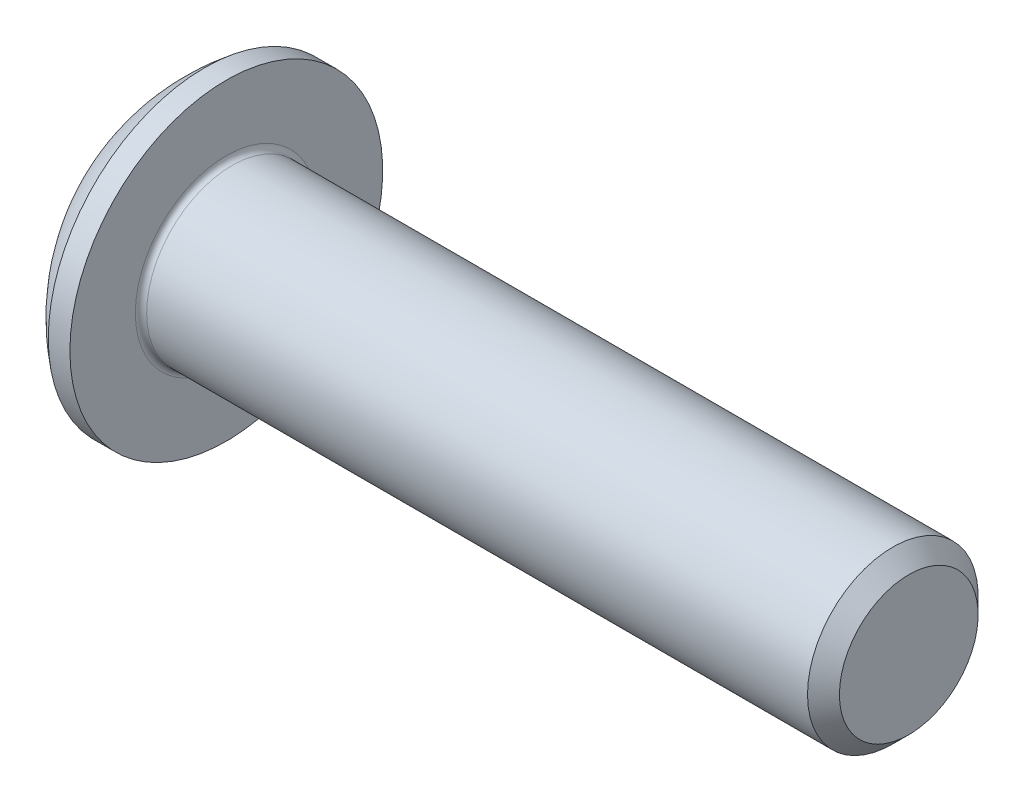
from build123d import *

# Parameters (mm, degrees)
FILLET1_R   = 0.1
HEX_2_DEPTH = 1.04


with BuildPart() as part:
    # BodySke → BaseBody (revolve)
    with BuildSketch(Plane.XY, mode=Mode.PRIVATE) as basebody_sk:
        with BuildLine():
            Line((13.45, 0), (13.45, 1.2195))
            Line((13.45, 1.2195), (13.1695, 1.5))
            Line((13.1695, 1.5), (1.45, 1.5))
            Line((1.45, 1.5), (1.45, 2.75))
            Line((1.45, 2.75), (1.07, 2.75))
            ThreePointArc((1.07, 2.75), (0.447284799, 2.130758374), (0, 1.375))
            Line((0, 1.375), (0, 0))
            Line((0, 0), (13.45, 0))
        make_face()
    revolve(basebody_sk.sketch.rotate(Axis((0, 0, 0), (1, 0, 0)), 90), axis=Axis((0, 0, 0), (1, 0, 0)))

    # Fillet1
    fillet1_edges = [part.edges().sort_by_distance(p)[0] for p in [
        (1.45, 0, -1.5),
    ]]
    fillet(fillet1_edges, radius=FILLET1_R)

    # Sketch2 → PreBroach (revolve, cut)
    with BuildSketch(Plane.XY, mode=Mode.PRIVATE) as prebroach_sk:
        Polygon((0, 1), (1.04, 1), (1.617350269, 0), (0, 0), align=None)
    revolve(prebroach_sk.sketch.rotate(Axis((0, 0, 0), (1, 0, 0)), 90), axis=Axis((0, 0, 0), (1, 0, 0)), mode=Mode.SUBTRACT)

    # Sketch3 → Hex 2 (cut)
    with BuildSketch(Plane(origin=(0, 0, 0), x_dir=(0, 0, -1), z_dir=(1, 0, 0))):
        Polygon((-1, -0.577350269), (-1, 0.577350269), (0, 1.154700538), (1, 0.577350269), (1, -0.577350269), (0, -1.154700538), align=None)
    extrude(amount=HEX_2_DEPTH, mode=Mode.SUBTRACT)


solid = part.part
